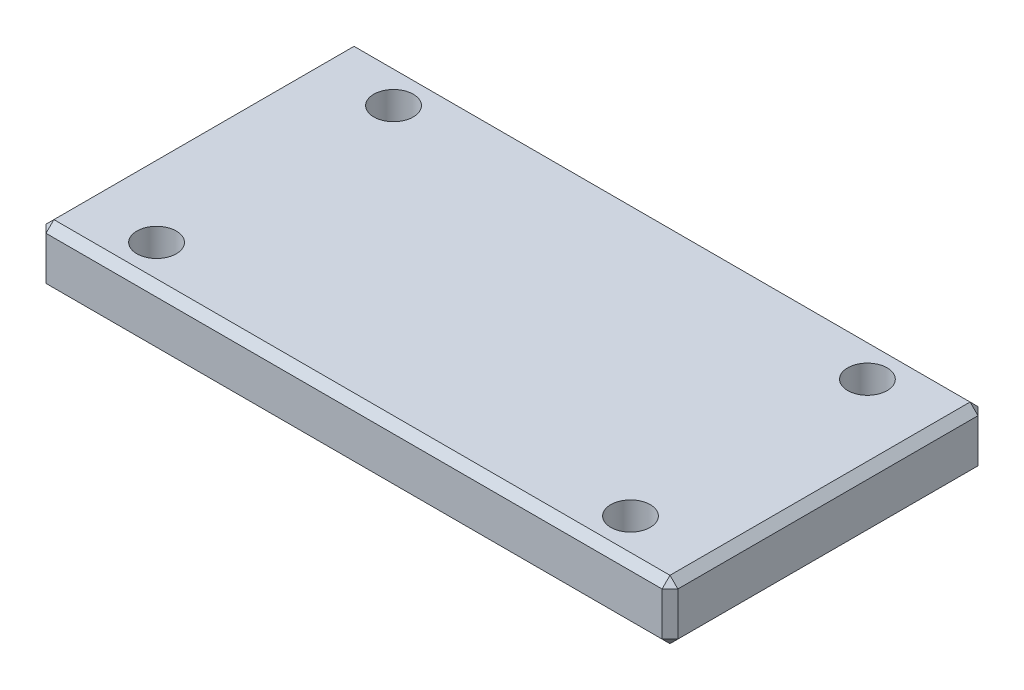
from build123d import *

# Parameters (mm, degrees)
SKETCH1_W           = 101.6
SKETCH1_H           = 50.8
BOSS_EXTRUDE1_DEPTH = 9.525
CHAMFER1_SIZE       = 1.27
SKETCH2_R           = 3.175
CUT_EXTRUDE1_DEPTH  = 58.589283942


with BuildPart() as part:
    # Sketch1 → Boss-Extrude1 (new body)
    with BuildSketch(Plane(origin=(0, 0, 0), x_dir=(1, 0, 0), z_dir=(0, 1, 0))):
        Rectangle(SKETCH1_W, SKETCH1_H)
    extrude(amount=BOSS_EXTRUDE1_DEPTH)

    # Chamfer1
    chamfer1_edges = [part.edges().sort_by_distance(p)[0] for p in [
        (50.8, 9.525, 0),
        (0, 9.525, -25.4),
        (-50.8, 9.525, 0),
        (0, 0, -25.4),
        (50.8, 0, 0),
        (0, 0, 25.4),
        (-50.8, 0, 0),
        (-50.8, 4.7625, -25.4),
        (50.8, 4.7625, -25.4),
        (50.8, 4.7625, 25.4),
        (-50.8, 4.7625, 25.4),
        (0, 9.525, 25.4),
    ]]
    chamfer(chamfer1_edges, length=CHAMFER1_SIZE)

    # Sketch2 → Cut-Extrude1 (cut, through all)
    with BuildSketch(Plane(origin=(0, 9.525, 0), x_dir=(1, 0, 0), z_dir=(0, 1, 0))):
        with Locations(Location((-38.1, 19.05, 0), (0, 0, 270))):
            Circle(SKETCH2_R)
        with Locations(Location((-38.1, -19.05, 0), (0, 0, 270))):
            Circle(SKETCH2_R)
        with Locations(Location((38.1, -19.05, 0), (0, 0, 270))):
            Circle(SKETCH2_R)
        with Locations(Location((38.1, 19.05, 0), (0, 0, 270))):
            Circle(SKETCH2_R)
    extrude(amount=-CUT_EXTRUDE1_DEPTH, mode=Mode.SUBTRACT)


solid = part.part
